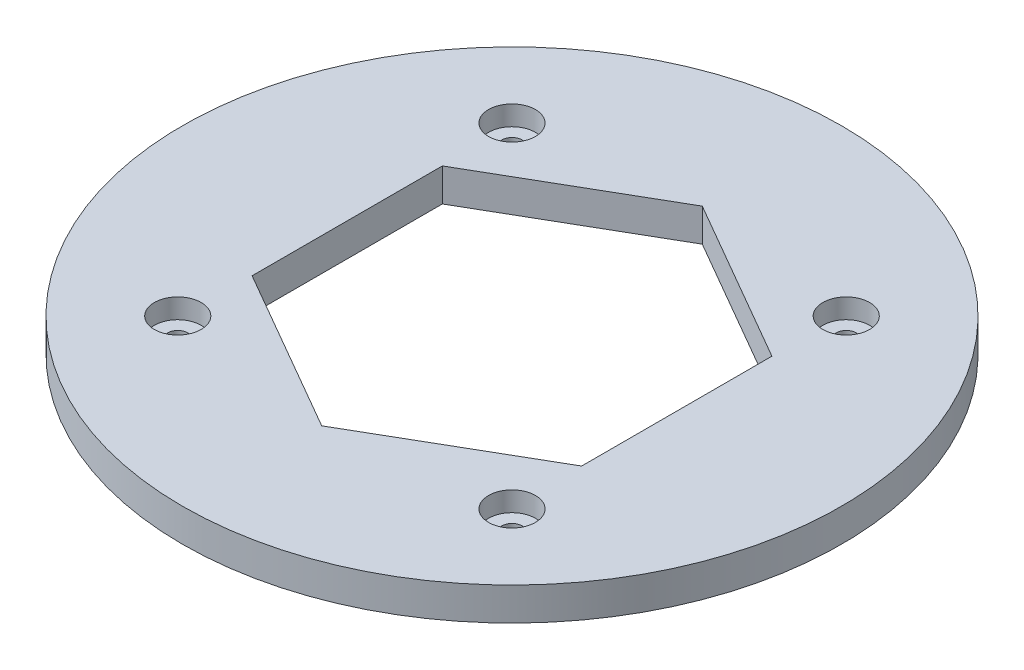
from build123d import *

# Parameters (mm, degrees)
SKETCH1_R           = 50
SKETCH1_R_2         = 3.55
BOSS_EXTRUDE1_DEPTH = 5
SKETCH1_3_R         = 3.55
SKETCH1_3_R_2       = 1.55
BOSS_EXTRUDE2_DEPTH = 2
SKETCH2_R           = 5.5
CUT_EXTRUDE1_DEPTH  = 2.5
CUT_EXTRUDE2_DEPTH  = 10


with BuildPart() as part:
    # Sketch1 → Boss-Extrude1 (new body)
    with BuildSketch(Plane(origin=(0, 0, 0), x_dir=(1, 0, 0), z_dir=(0, 1, 0))):
        Circle(SKETCH1_R)
        with Locations((-25.355339059, -25.355339059)):
            Circle(SKETCH1_R_2, mode=Mode.SUBTRACT)
        with Locations((25.355339059, -25.355339059)):
            Circle(SKETCH1_R_2, mode=Mode.SUBTRACT)
        with Locations((-25.355339059, 25.355339059)):
            Circle(SKETCH1_R_2, mode=Mode.SUBTRACT)
        with Locations((25.355339059, 25.355339059)):
            Circle(SKETCH1_R_2, mode=Mode.SUBTRACT)
    extrude(amount=BOSS_EXTRUDE1_DEPTH)

    # Sketch1<3> → Boss-Extrude2 (add)
    # profile 1 of 4: a face of its own
    with BuildSketch(Plane(origin=(0, 0, 0), x_dir=(1, 0, 0), z_dir=(0, 1, 0))):
        with Locations((-25.355339059, 25.355339059)):
            Circle(SKETCH1_3_R)
        with Locations((-25.355339059, 25.355339059)):
            Circle(SKETCH1_3_R_2, mode=Mode.SUBTRACT)
    # profile 2 of 4: a face of its own
    with BuildSketch(Plane(origin=(0, 0, 0), x_dir=(1, 0, 0), z_dir=(0, 1, 0))):
        with Locations((25.355339059, 25.355339059)):
            Circle(SKETCH1_3_R)
        with Locations((25.355339059, 25.355339059)):
            Circle(SKETCH1_3_R_2, mode=Mode.SUBTRACT)
    # profile 3 of 4: a face of its own
    with BuildSketch(Plane(origin=(0, 0, 0), x_dir=(1, 0, 0), z_dir=(0, 1, 0))):
        with Locations((-25.355339059, -25.355339059)):
            Circle(SKETCH1_3_R)
        with Locations((-25.355339059, -25.355339059)):
            Circle(SKETCH1_3_R_2, mode=Mode.SUBTRACT)
    # profile 4 of 4: a face of its own
    with BuildSketch(Plane(origin=(0, 0, 0), x_dir=(1, 0, 0), z_dir=(0, 1, 0))):
        with Locations((25.355339059, -25.355339059)):
            Circle(SKETCH1_3_R)
        with Locations((25.355339059, -25.355339059)):
            Circle(SKETCH1_3_R_2, mode=Mode.SUBTRACT)
    extrude(amount=BOSS_EXTRUDE2_DEPTH)

    # Sketch2 → Cut-Extrude1 (cut)
    with BuildSketch(Plane.XZ):
        with Locations((0, 35.355339059)):
            Circle(SKETCH2_R)
    extrude(amount=-CUT_EXTRUDE1_DEPTH, mode=Mode.SUBTRACT)

    # Sketch3 → Cut-Extrude2 (cut)
    with BuildSketch(Plane(origin=(0, 5, 0), x_dir=(1, 0, 0), z_dir=(0, 1, 0))):
        Polygon((0, 28.867513459), (-25, 14.43375673), (-25, -14.43375673), (0, -28.867513459), (25, -14.43375673), (25, 14.43375673), align=None)
    extrude(amount=-CUT_EXTRUDE2_DEPTH, mode=Mode.SUBTRACT)


solid = part.part
